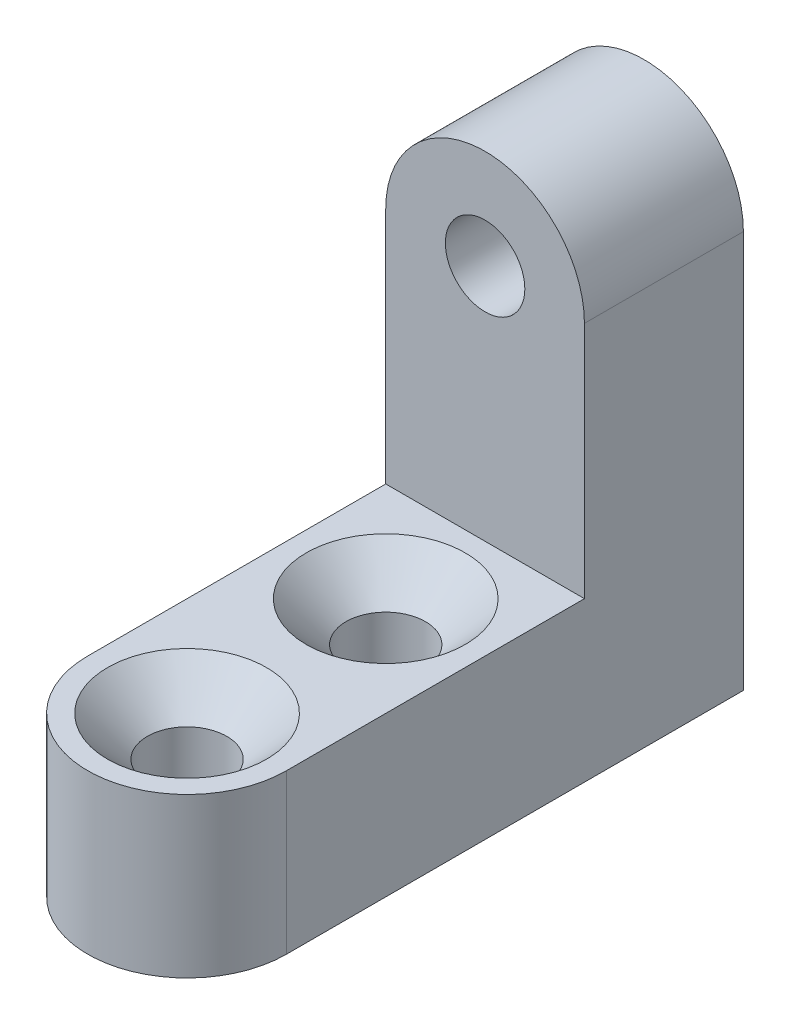
from build123d import *

# Parameters (mm, degrees)
SKETCH_1_R      = 2
EXTRUDE_1_DEPTH = 8
SKETCH_2_R      = 2
EXTRUDE_2_DEPTH = 8
CHAMFER_1_SIZE  = 2


with BuildPart() as part:
    # 草图1 → 凸台-拉伸1 (new body)
    with BuildSketch(Plane.XY):
        with BuildLine():
            Line((-5, 20), (-5, 0))
            Line((-5, 0), (5, 0))
            Line((5, 0), (5, 20))
            ThreePointArc((5, 20), (0, 25), (-5, 20))
        make_face()
        with Locations((0, 20)):
            Circle(SKETCH_1_R, mode=Mode.SUBTRACT)
    extrude(amount=EXTRUDE_1_DEPTH)

    # 草图2 → 凸台-拉伸2 (add)
    with BuildSketch(Plane(origin=(0, 0, 0), x_dir=(1, 0, 0), z_dir=(0, 1, 0))):
        with BuildLine():
            Line((-5, -8), (5, -8))
            Line((5, -8), (5, -23))
            ThreePointArc((5, -23), (0, -28), (-5, -23))
            Line((-5, -23), (-5, -8))
        make_face()
        with Locations(Location((0, -23, 0), (0, 0, 270))):
            Circle(SKETCH_2_R, mode=Mode.SUBTRACT)
        with Locations(Location((0, -13, 0), (0, 0, 270))):
            Circle(SKETCH_2_R, mode=Mode.SUBTRACT)
    extrude(amount=EXTRUDE_2_DEPTH)

    # 倒角1
    chamfer_1_edges = [part.edges().sort_by_distance(p)[0] for p in [
        (0, 8, 21),
        (0, 8, 11),
    ]]
    chamfer(chamfer_1_edges, length=CHAMFER_1_SIZE)


solid = part.part
